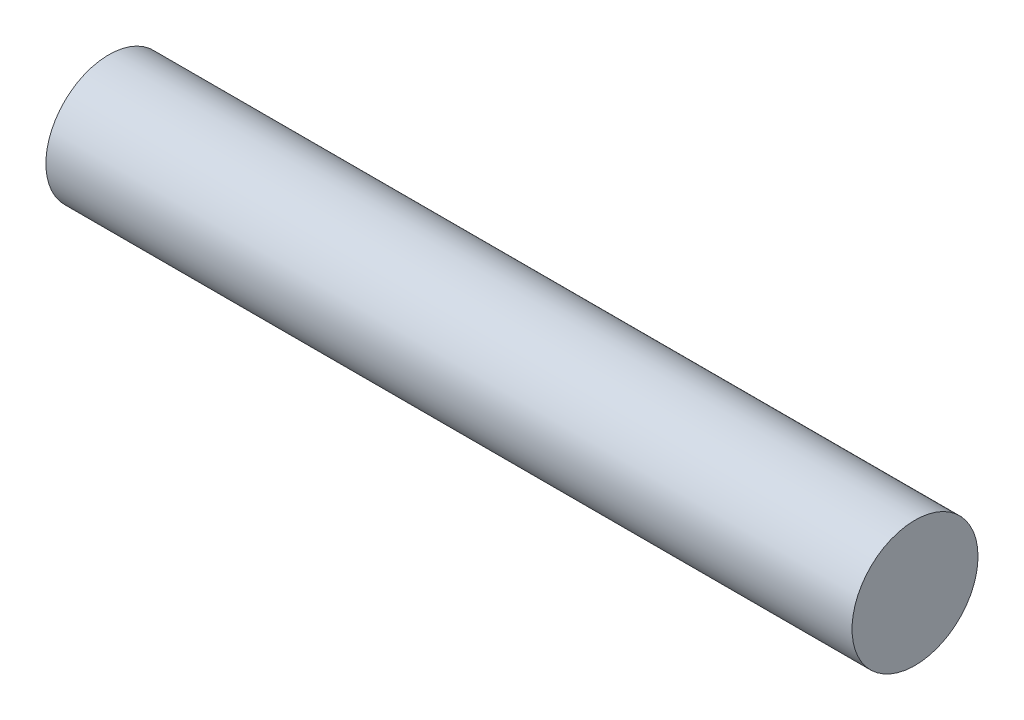
from build123d import *

# Parameters (mm, degrees)
SKETCH1_R           = 15.875
BOSS_EXTRUDE1_DEPTH = 203.2


with BuildPart() as part:
    # Sketch1 → Boss-Extrude1 (new body)
    with BuildSketch(Plane(origin=(0, 0, 0), x_dir=(0, 0, -1), z_dir=(1, 0, 0))):
        Circle(SKETCH1_R)
    extrude(amount=BOSS_EXTRUDE1_DEPTH)


solid = part.part
